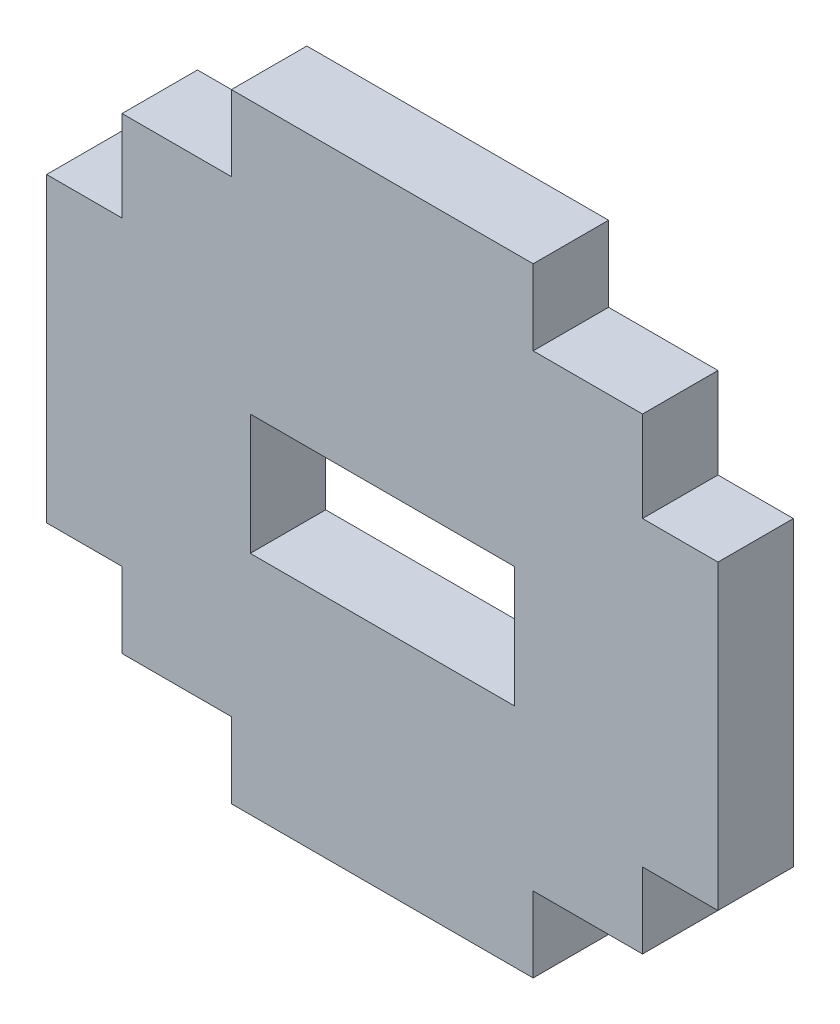
from build123d import *

# Parameters (mm, degrees)
SKETCH1_W           = 17.5
SKETCH1_H           = 8
BOSS_EXTRUDE1_DEPTH = 5


with BuildPart() as part:
    # Sketch1 → Boss-Extrude1 (new body)
    with BuildSketch(Plane.XY):
        Polygon((0, 0), (7.25, 0), (7.25, -5), (27.25, -5), (27.25, 0), (34.5, 0), (34.5, 5), (39.5, 5), (39.5, 25), (34.5, 25), (34.5, 31), (27.25, 31), (27.25, 36), (7.25, 36), (7.25, 31), (0, 31), (0, 25), (-5, 25), (-5, 5), (0, 5), align=None)
        with Locations((17.25, 14)):
            Rectangle(SKETCH1_W, SKETCH1_H, mode=Mode.SUBTRACT)
    extrude(amount=BOSS_EXTRUDE1_DEPTH)


solid = part.part
